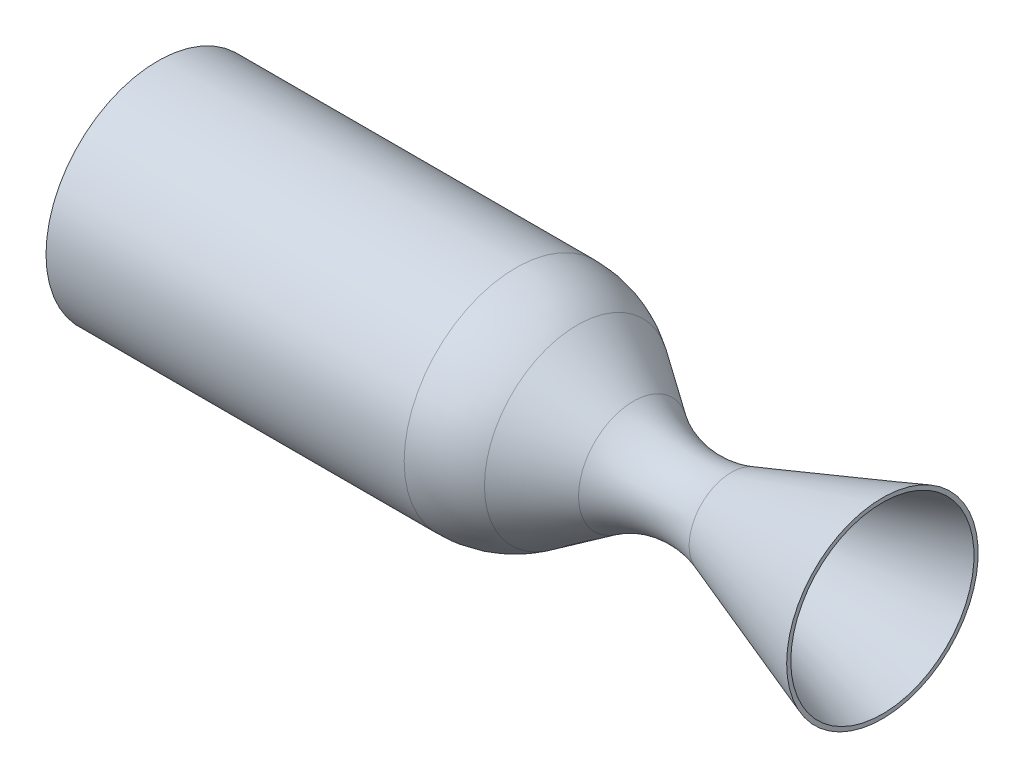
from build123d import *


with BuildPart() as part:
    # Sketch1 → Revolve1 (revolve)
    with BuildSketch(Plane.XY, mode=Mode.PRIVATE) as revolve1_sk:
        with BuildLine():
            Line((0, 0), (182.844096167, 0))
            ThreePointArc((182.844096167, 0), (199.247500633, -2.456295217), (214.211919245, -9.609702789))
            Line((214.211919245, -9.609702789), (242.861384298, -28.981670746))
            ThreePointArc((242.861384298, -28.981670746), (267.125171613, -38.138944822), (292.912582145, -35.382769683))
            Line((292.912582145, -35.382769683), (369.969238449, -8.111689674))
            Line((369.969238449, -8.111689674), (369.969238449, -10.233247507))
            Line((369.969238449, -10.233247507), (293.57984553, -37.268176688))
            ThreePointArc((293.57984553, -37.268176688), (266.87145605, -40.122786653), (241.741104903, -30.638467075))
            Line((241.741104903, -30.638467075), (213.09163985, -11.266499118))
            ThreePointArc((213.09163985, -11.266499118), (198.66166476, -4.368570388), (182.844096167, -2))
            Line((182.844096167, -2), (0, -2))
            Line((0, -2), (0, 0))
        make_face()
    revolve(revolve1_sk.sketch.rotate(Axis((0, -57, 0), (1, 0, 0)), 90), axis=Axis((0, -57, 0), (1, 0, 0)))


solid = part.part
